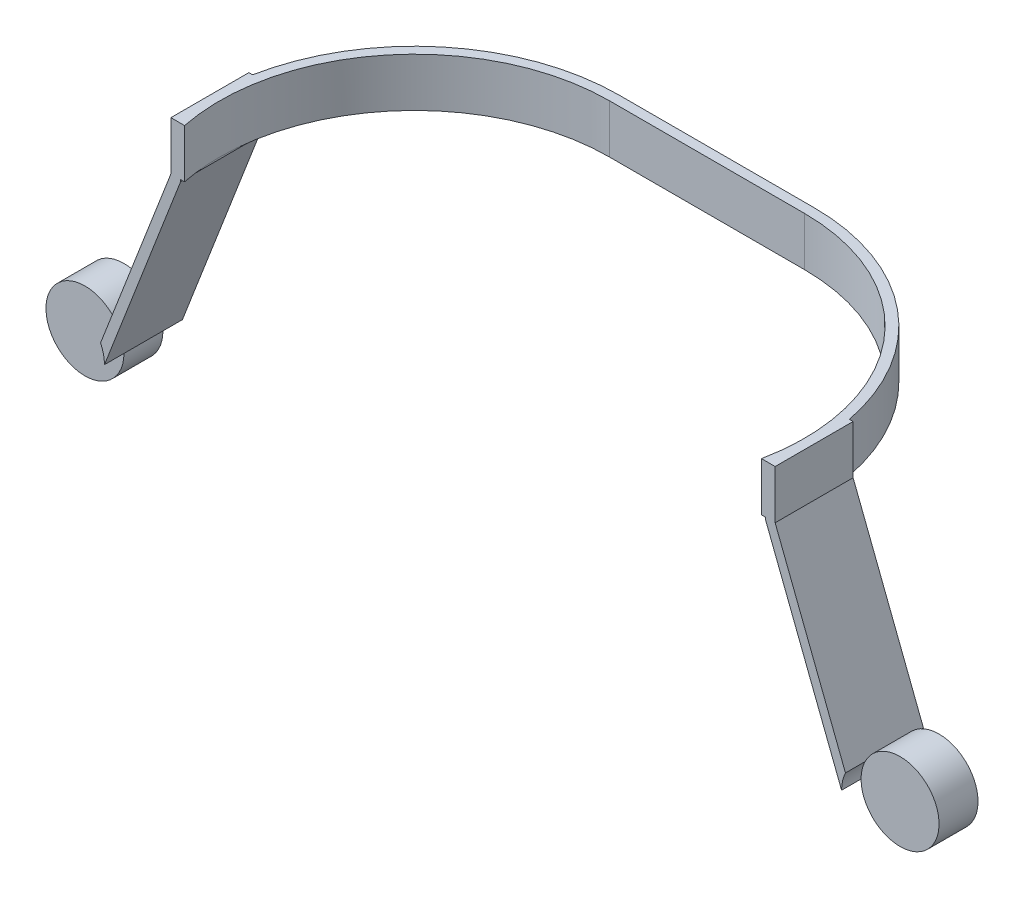
from build123d import *

# Parameters (mm, degrees)
EXTRUDE_1_DEPTH     = 20
SKETCH_8_W          = 4
SKETCH_8_H          = 32
SKETCH_11_W         = 4
SKETCH_11_H         = 32
SKETCH_13_R         = 16
CUT_EXTRUDE_4_DEPTH = 202.639119047
SKETCH_16_R         = 16
EXTRUDE_4_DEPTH     = 8
SKETCH_17_W         = 276.65605666
SKETCH_17_H         = 73.661463051
CUT_EXTRUDE_5_DEPTH = 234.318180858


with BuildPart() as part:
    # 草图2 → 凸台-拉伸1 (new body)
    with BuildSketch(Plane(origin=(0, 0, 0), x_dir=(1, 0, 0), z_dir=(0, 1, 0))):
        with BuildLine():
            Line((-40, 84), (40, 84))
            ThreePointArc((40, 84), (124, 0), (40, -84))
            Line((40, -84), (-40, -84))
            ThreePointArc((-40, -84), (-124, 0), (-40, 84))
        make_face()
        with BuildLine():
            Line((-40, 80), (40, 80))
            ThreePointArc((40, 80), (120, 0), (40, -80))
            Line((40, -80), (-40, -80))
            ThreePointArc((-40, -80), (-120, 0), (-40, 80))
        make_face(mode=Mode.SUBTRACT)
    extrude(amount=EXTRUDE_1_DEPTH)

    # 扫描1: sweep along a path in 草图9
    with BuildLine(Plane.XY) as sweep_1_path:
        Line((-124, 20), (-124, 0))
        Line((-124, 0), (-155, -80))
    # 草图8 → 扫描1 (sweep)
    with BuildSketch(Plane(origin=(0, 20, 0), x_dir=(1, 0, 0), z_dir=(0, 1, 0))):
        with Locations((-122, 0)):
            Rectangle(SKETCH_8_W, SKETCH_8_H)
    sweep(path=sweep_1_path.line, transition=Transition.RIGHT)

    # 扫描2: sweep along a path in 草图12
    with BuildLine(Plane.XY) as sweep_2_path:
        Line((124, 20), (124, 0))
        Line((124, 0), (155, -80))
    # 草图11 → 扫描2 (sweep)
    with BuildSketch(Plane(origin=(0, 20, 0), x_dir=(1, 0, 0), z_dir=(0, 1, 0))):
        with Locations((122, 0)):
            Rectangle(SKETCH_11_W, SKETCH_11_H)
    sweep(path=sweep_2_path.line, transition=Transition.RIGHT)

    # 草图13 → 切除-拉伸4 (cut, through all)
    with BuildSketch(Plane.XY.offset(16)):
        with Locations((-167.270234139, -81.445284271)):
            Circle(SKETCH_13_R)
        with Locations((167.270234139, -81.445284271)):
            Circle(SKETCH_13_R)
    extrude(amount=-CUT_EXTRUDE_4_DEPTH, mode=Mode.SUBTRACT)

    # 草图16 → 凸台-拉伸4 (add, symmetric)
    with BuildSketch(Plane.XY):
        with Locations((167.270234139, -81.445284271)):
            Circle(SKETCH_16_R)
        with Locations((-167.270234139, -81.445284271)):
            Circle(SKETCH_16_R)
    extrude(amount=EXTRUDE_4_DEPTH, both=True)

    # 草图17 → 切除-拉伸5 (cut, through all)
    with BuildSketch(Plane(origin=(0, 20, 0), x_dir=(1, 0, 0), z_dir=(0, 1, 0))):
        with Locations((14.32802833, -52.830731526)):
            Rectangle(SKETCH_17_W, SKETCH_17_H)
    extrude(amount=-CUT_EXTRUDE_5_DEPTH, mode=Mode.SUBTRACT)


solid = part.part
